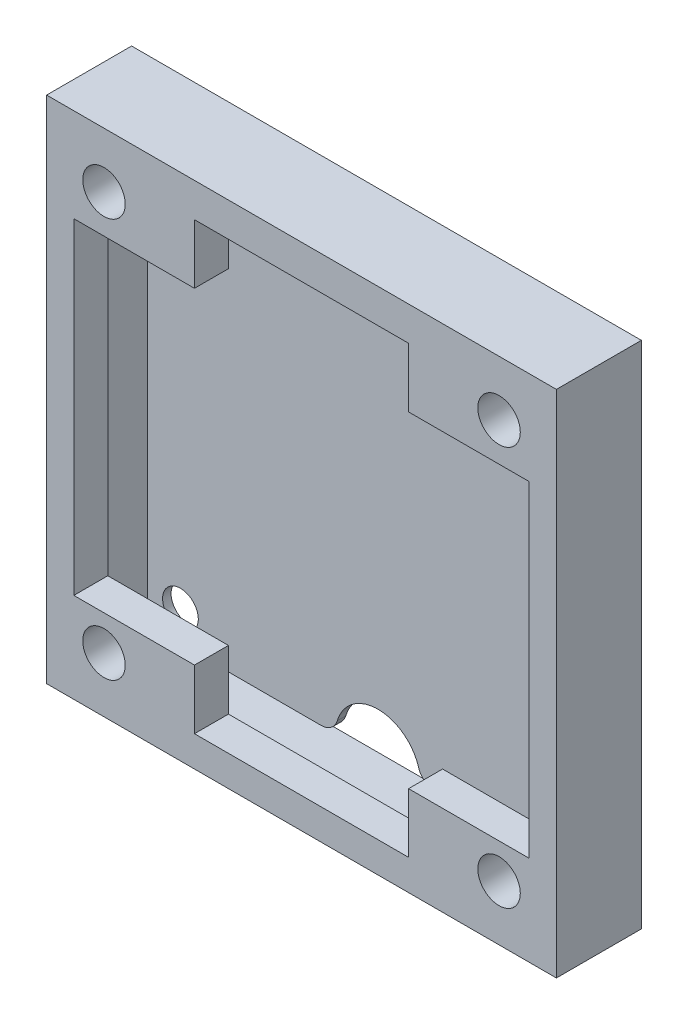
from build123d import *

# Parameters (mm, degrees)
SKETCH1_W           = 30
SKETCH1_H           = 30
SKETCH1_R           = 1.25
SKETCH1_W_2         = 26.8
SKETCH1_H_2         = 19.2
BOSS_EXTRUDE1_DEPTH = 2
SKETCH2_W           = 12.6
SKETCH2_H           = 3.5
CUT_EXTRUDE1_DEPTH  = 3
SKETCH3_W           = 30
SKETCH3_H           = 30
SKETCH3_W_2         = 27.5
SKETCH3_H_2         = 27.5
BOSS_EXTRUDE3_DEPTH = 3
SKETCH4_R           = 1.05
BOSS_EXTRUDE4_DEPTH = 0.5
FILLET1_R           = 1


with BuildPart() as part:
    # Sketch1 → Boss-Extrude1 (new body)
    with BuildSketch(Plane.XY):
        Rectangle(SKETCH1_W, SKETCH1_H)
        with Locations((-11.625, 11.75)):
            Circle(SKETCH1_R, mode=Mode.SUBTRACT)
        with Locations((11.625, 11.75)):
            Circle(SKETCH1_R, mode=Mode.SUBTRACT)
        with Locations((11.625, -11.75)):
            Circle(SKETCH1_R, mode=Mode.SUBTRACT)
        with Locations((-11.625, -11.75)):
            Circle(SKETCH1_R, mode=Mode.SUBTRACT)
        with Locations((0, -0.1)):
            Rectangle(SKETCH1_W_2, SKETCH1_H_2, mode=Mode.SUBTRACT)
    extrude(amount=BOSS_EXTRUDE1_DEPTH)

    # Sketch2 → Cut-Extrude1 (cut)
    with BuildSketch(Plane.XY.offset(2)):
        with Locations((0, -11.45)):
            Rectangle(SKETCH2_W, SKETCH2_H)
        with Locations((0, 11.25)):
            Rectangle(SKETCH2_W, SKETCH2_H)
    extrude(amount=-CUT_EXTRUDE1_DEPTH, mode=Mode.SUBTRACT)

    # Sketch3 → Boss-Extrude3 (add)
    with BuildSketch(Plane(origin=(0, 0, 0), x_dir=(-1, 0, 0), z_dir=(0, 0, -1))):
        Rectangle(SKETCH3_W, SKETCH3_H)
        Rectangle(SKETCH3_W_2, SKETCH3_H_2, mode=Mode.SUBTRACT)
    extrude(amount=BOSS_EXTRUDE3_DEPTH)


with BuildPart() as body_2:
    # Sketch4 → Boss-Extrude4 (new body)
    with BuildSketch(Plane(origin=(0, 0, -3), x_dir=(-1, 0, 0), z_dir=(0, 0, -1))):
        with BuildLine():
            Line((2.5, -13.55), (13.55, -13.55))
            Line((13.55, -13.55), (13.55, 13.55))
            Line((13.55, 13.55), (-13.55, 13.55))
            Line((-13.55, 13.55), (-13.55, -13.55))
            Line((-13.55, -13.55), (-2.5, -13.55))
            ThreePointArc((-2.5, -13.55), (0, -11.05), (2.5, -13.55))
        make_face()
        with Locations((-11.625, 11.75)):
            Circle(SKETCH4_R, mode=Mode.SUBTRACT)
        with Locations((11.625, 11.75)):
            Circle(SKETCH4_R, mode=Mode.SUBTRACT)
        with Locations((-11.625, -11.75)):
            Circle(SKETCH4_R, mode=Mode.SUBTRACT)
        with Locations((11.625, -11.75)):
            Circle(SKETCH4_R, mode=Mode.SUBTRACT)
    extrude(amount=-BOSS_EXTRUDE4_DEPTH)

    # Fillet1
    fillet1_edges = [body_2.edges().sort_by_distance(p)[0] for p in [
        (2.5, -13.55, -2.75),
        (-2.5, -13.55, -2.75),
    ]]
    fillet(fillet1_edges, radius=FILLET1_R)


solid = Compound([part.part, body_2.part])
